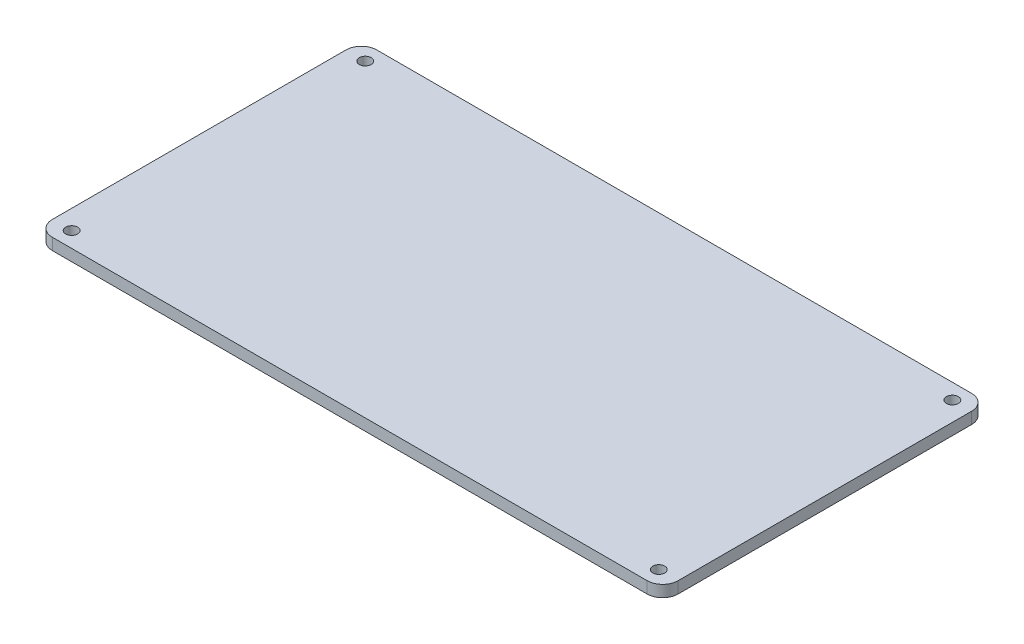
from build123d import *

# Parameters (mm, degrees)
SKETCH1_R           = 1.55
BOSS_EXTRUDE1_DEPTH = 3


with BuildPart() as part:
    # Sketch1 → Boss-Extrude1 (new body)
    with BuildSketch(Plane(origin=(0, 0, 0), x_dir=(1, 0, 0), z_dir=(0, 1, 0))):
        with BuildLine():
            Line((-77, -42), (77, -42))
            ThreePointArc((77, -42), (79.828427125, -40.828427125), (81, -38))
            Line((81, -38), (81, 38))
            ThreePointArc((81, 38), (79.828427125, 40.828427125), (77, 42))
            Line((77, 42), (-77, 42))
            ThreePointArc((-77, 42), (-79.828427125, 40.828427125), (-81, 38))
            Line((-81, 38), (-81, -38))
            ThreePointArc((-81, -38), (-79.828427125, -40.828427125), (-77, -42))
        make_face()
        with Locations(Location((-76, 38, 0), (0, 0, 270))):
            Circle(SKETCH1_R, mode=Mode.SUBTRACT)
        with Locations(Location((-76, -38, 0), (0, 0, 90))):
            Circle(SKETCH1_R, mode=Mode.SUBTRACT)
        with Locations(Location((76, 38, 0), (0, 0, 90))):
            Circle(SKETCH1_R, mode=Mode.SUBTRACT)
        with Locations(Location((76, -38, 0), (0, 0, 270))):
            Circle(SKETCH1_R, mode=Mode.SUBTRACT)
    extrude(amount=BOSS_EXTRUDE1_DEPTH)


solid = part.part
